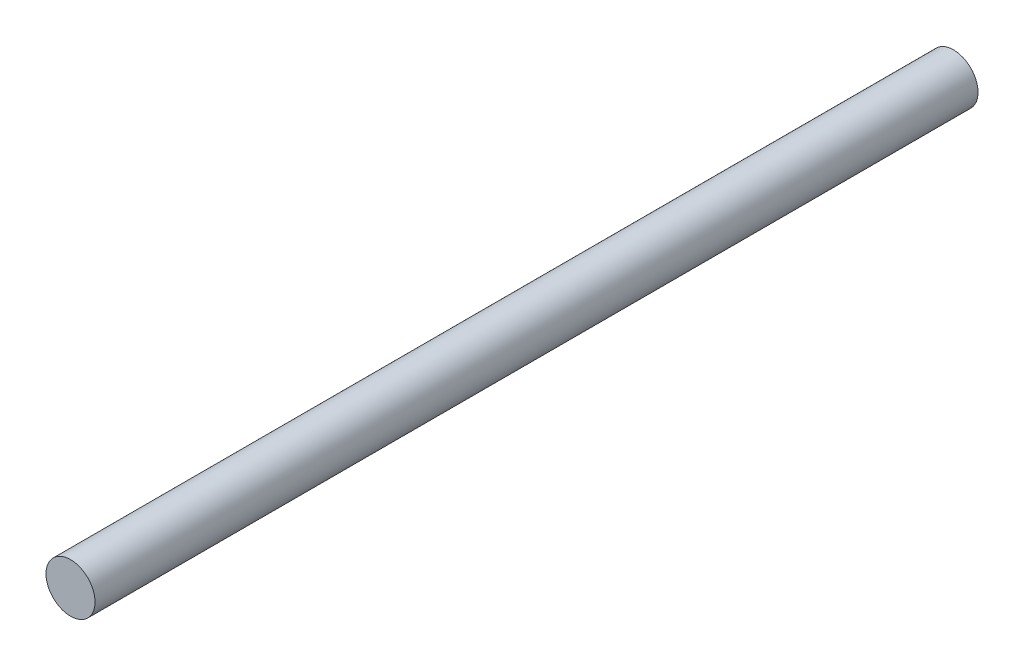
from build123d import *

# Parameters (mm, degrees)
ESQUISSE1_R        = 5
BOSS_EXTRU_1_DEPTH = 180


with BuildPart() as part:
    # Esquisse1 → Boss.-Extru.1 (new body)
    with BuildSketch(Plane.XY):
        with Locations(Location((0, 0, 0), (0, 0, 180))):
            Circle(ESQUISSE1_R)
    extrude(amount=BOSS_EXTRU_1_DEPTH)


solid = part.part
